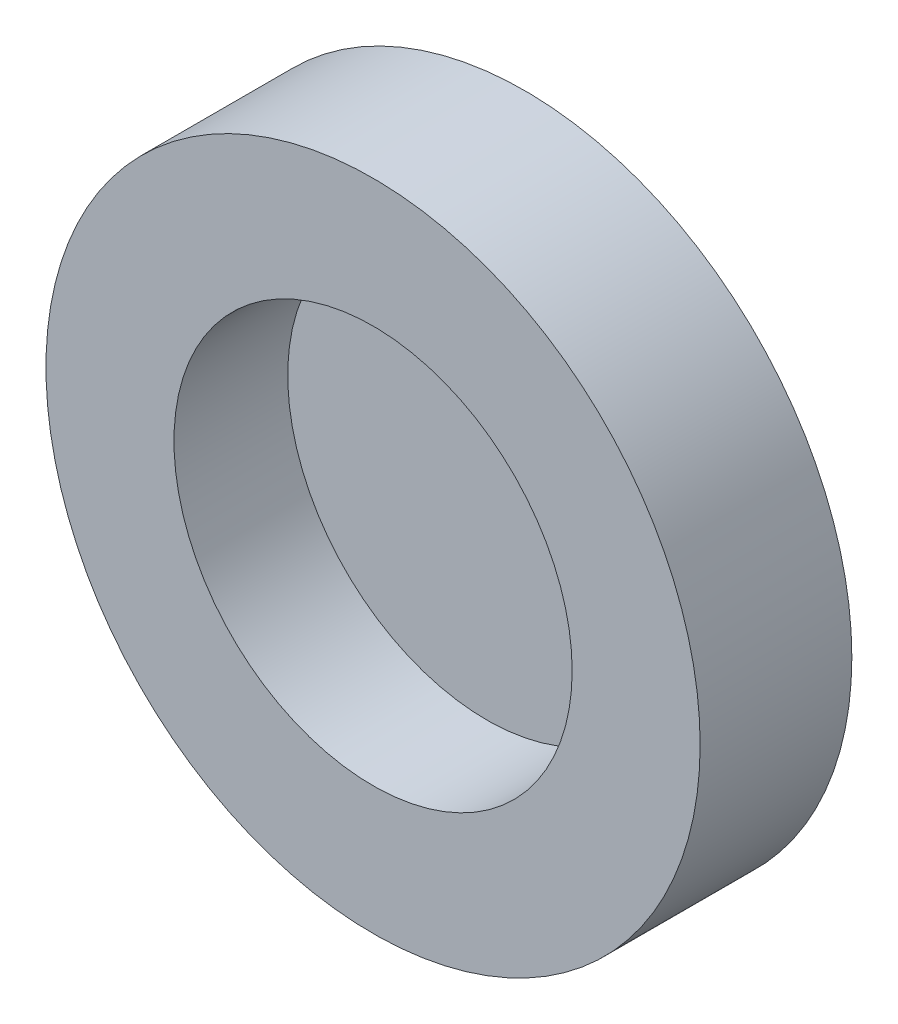
from build123d import *

# Parameters (mm, degrees)
SKETCH1_R               = 17.25
BOSS_EXTRUDE1_DEPTH     = 8
CUT_EXTRUDE1_DEPTH      = 1
CUT_EXTRUDE1_DEPTH_BACK = 6
SKETCH2_R               = 10.5


with BuildPart() as part:
    # Sketch1 → Boss-Extrude1 (new body)
    with BuildSketch(Plane.XY):
        Circle(SKETCH1_R)
    extrude(amount=BOSS_EXTRUDE1_DEPTH)

    # Sketch2 → Cut-Extrude1 (cut, two sides: drawn at the far end of the back side and taken through both)
    with BuildSketch(Plane.XY.offset(8).offset(-CUT_EXTRUDE1_DEPTH_BACK)):
        Circle(SKETCH2_R)
    extrude(amount=CUT_EXTRUDE1_DEPTH + CUT_EXTRUDE1_DEPTH_BACK, mode=Mode.SUBTRACT)


solid = part.part
